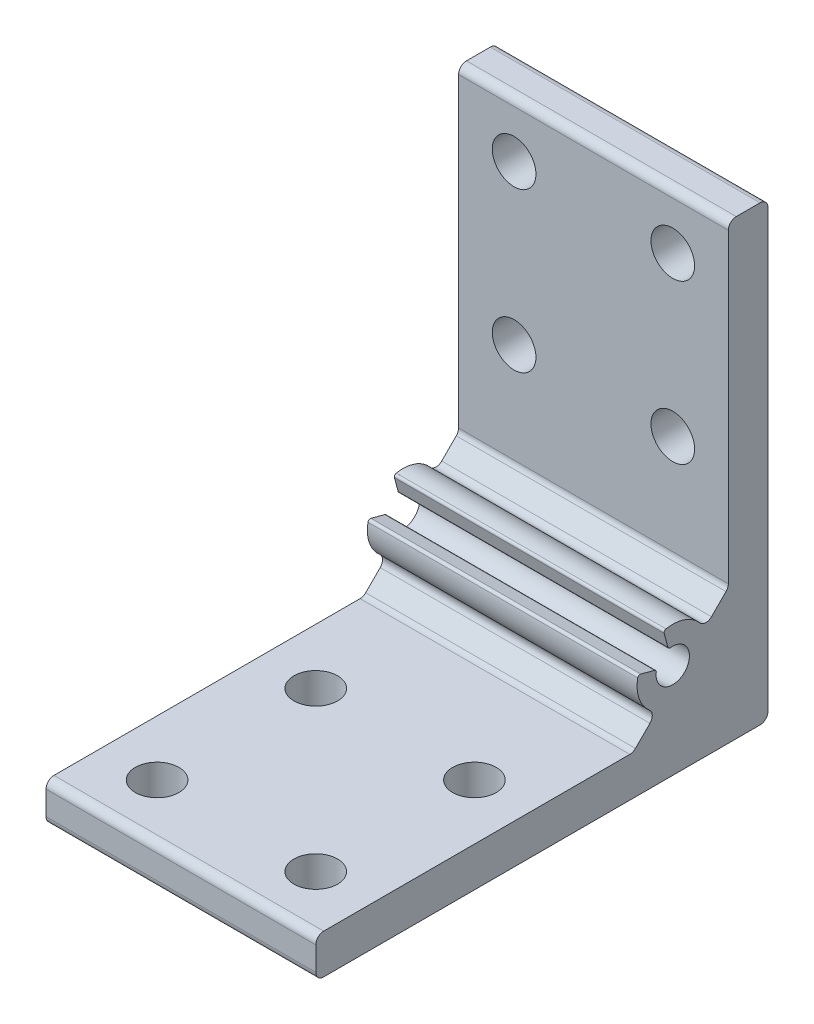
from build123d import *

# Parameters (mm, degrees)
BOSS_EXTRUDE1_DEPTH      = 17
BOSS_EXTRUDE1_DEPTH_BACK = 17
SKETCH2_R                = 2.75
CUT_EXTRUDE1_DEPTH       = 5
SKETCH3_R                = 2.75
CUT_EXTRUDE2_DEPTH       = 5
SKETCH4_R                = 2.75
CUT_EXTRUDE3_DEPTH       = 5
SKETCH5_R                = 2.75
CUT_EXTRUDE4_DEPTH       = 5
SKETCH6_R                = 2.75
CUT_EXTRUDE5_DEPTH       = 5
SKETCH7_R                = 2.75
CUT_EXTRUDE6_DEPTH       = 5
SKETCH8_R                = 2.75
CUT_EXTRUDE7_DEPTH       = 5
SKETCH9_R                = 2.75
CUT_EXTRUDE8_DEPTH       = 5


with BuildPart() as part:
    # Sketch1 → Boss-Extrude1 (new, two sides: drawn at the far end of the back side and taken through both)
    with BuildSketch(Plane(origin=(0, 0, 0), x_dir=(0, 0, -1), z_dir=(1, 0, 0)).offset(-BOSS_EXTRUDE1_DEPTH_BACK)):
        with BuildLine():
            Line((-56, 0), (-1, 0))
            ThreePointArc((-1, 0), (-0.292893219, 0.292893219), (0, 1))
            Line((0, 1), (0, 56))
            ThreePointArc((0, 56), (-0.292893219, 56.707106781), (-1, 57))
            Line((-1, 57), (-4, 57))
            ThreePointArc((-4, 57), (-4.707106781, 56.707106781), (-5, 56))
            Line((-5, 56), (-5, 17.414213562))
            ThreePointArc((-5, 17.414213562), (-5.076120467, 17.03153013), (-5.292893219, 16.707106781))
            Line((-5.292893219, 16.707106781), (-7.121957509, 14.878042491))
            ThreePointArc((-7.121957509, 14.878042491), (-7.866746832, 14.585859511), (-8.587416237, 14.93330395))
            ThreePointArc((-8.587416237, 14.93330395), (-10.519537564, 16.249497732), (-12.851234525, 16.418755456))
            ThreePointArc((-12.851234525, 16.418755456), (-13.048766707, 16.283360738), (-13.084263382, 16.046526031))
            Line((-13.084263382, 16.046526031), (-12.616293745, 14.300039569))
            ThreePointArc((-12.616293745, 14.300039569), (-12.492491512, 14.127781044), (-12.285701536, 14.080474617))
            ThreePointArc((-12.285701536, 14.080474617), (-10.515075746, 10.515075773), (-14.080474622, 12.285701498))
            ThreePointArc((-14.080474622, 12.285701498), (-14.127781033, 12.492491496), (-14.300039569, 12.616293745))
            Line((-14.300039569, 12.616293745), (-16.046526031, 13.084263382))
            ThreePointArc((-16.046526031, 13.084263382), (-16.283360688, 13.048766739), (-16.418755434, 12.851234641))
            ThreePointArc((-16.418755434, 12.851234641), (-16.249497766, 10.51953766), (-14.933304014, 8.587416292))
            ThreePointArc((-14.933304014, 8.587416292), (-14.585859513, 7.866746874), (-14.878042491, 7.121957509))
            Line((-14.878042491, 7.121957509), (-16.707106781, 5.292893219))
            ThreePointArc((-16.707106781, 5.292893219), (-17.03153013, 5.076120467), (-17.414213562, 5))
            Line((-17.414213562, 5), (-56, 5))
            ThreePointArc((-56, 5), (-56.707106781, 4.707106781), (-57, 4))
            Line((-57, 4), (-57, 1))
            ThreePointArc((-57, 1), (-56.707106781, 0.292893219), (-56, 0))
        make_face()
    extrude(amount=BOSS_EXTRUDE1_DEPTH + BOSS_EXTRUDE1_DEPTH_BACK)

    # Sketch2 → Cut-Extrude1 (cut)
    with BuildSketch(Plane(origin=(0, 0, 0), x_dir=(1, 0, 0), z_dir=(0, 1, 0))):
        with Locations((-10, -30)):
            Circle(SKETCH2_R)
    extrude(amount=CUT_EXTRUDE1_DEPTH, mode=Mode.SUBTRACT)

    # Sketch3 → Cut-Extrude2 (cut)
    with BuildSketch(Plane(origin=(0, 0, 0), x_dir=(1, 0, 0), z_dir=(0, 1, 0))):
        with Locations((-10, -50)):
            Circle(SKETCH3_R)
    extrude(amount=CUT_EXTRUDE2_DEPTH, mode=Mode.SUBTRACT)

    # Sketch4 → Cut-Extrude3 (cut)
    with BuildSketch(Plane(origin=(0, 0, 0), x_dir=(1, 0, 0), z_dir=(0, 1, 0))):
        with Locations((10, -30)):
            Circle(SKETCH4_R)
    extrude(amount=CUT_EXTRUDE3_DEPTH, mode=Mode.SUBTRACT)

    # Sketch5 → Cut-Extrude4 (cut)
    with BuildSketch(Plane(origin=(0, 0, 0), x_dir=(1, 0, 0), z_dir=(0, 1, 0))):
        with Locations((10, -50)):
            Circle(SKETCH5_R)
    extrude(amount=CUT_EXTRUDE4_DEPTH, mode=Mode.SUBTRACT)

    # Sketch6 → Cut-Extrude5 (cut)
    with BuildSketch(Plane.XY):
        with Locations((-10, 30)):
            Circle(SKETCH6_R)
    extrude(amount=CUT_EXTRUDE5_DEPTH, mode=Mode.SUBTRACT)

    # Sketch7 → Cut-Extrude6 (cut)
    with BuildSketch(Plane.XY):
        with Locations((10, 30)):
            Circle(SKETCH7_R)
    extrude(amount=CUT_EXTRUDE6_DEPTH, mode=Mode.SUBTRACT)

    # Sketch8 → Cut-Extrude7 (cut)
    with BuildSketch(Plane.XY):
        with Locations((-10, 50)):
            Circle(SKETCH8_R)
    extrude(amount=CUT_EXTRUDE7_DEPTH, mode=Mode.SUBTRACT)

    # Sketch9 → Cut-Extrude8 (cut)
    with BuildSketch(Plane.XY):
        with Locations((10, 50)):
            Circle(SKETCH9_R)
    extrude(amount=CUT_EXTRUDE8_DEPTH, mode=Mode.SUBTRACT)


solid = part.part
